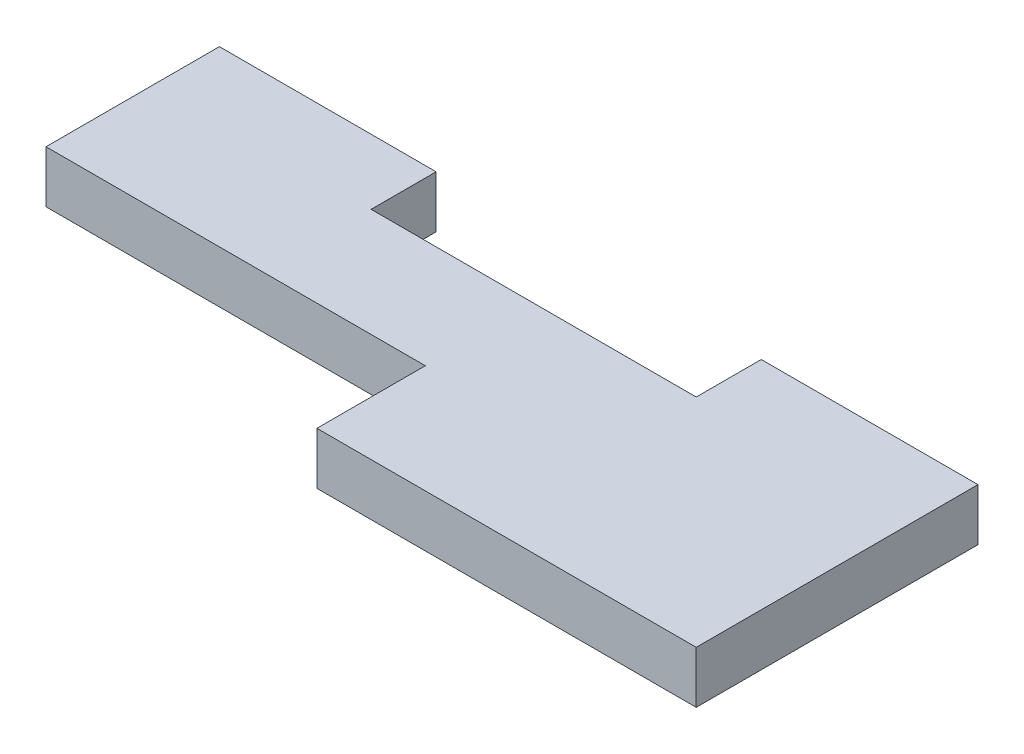
from build123d import *

# Parameters (mm, degrees)
BOSS_EXTRUDE1_DEPTH = 0.24


with BuildPart() as part:
    # Sketch1 → Boss-Extrude1 (new body)
    with BuildSketch(Plane(origin=(0, 0, 0), x_dir=(1, 0, 0), z_dir=(0, 1, 0))):
        Polygon((0, 1.3), (1, 1.3), (1, 1), (2.5, 1), (2.5, 1.3), (3.5, 1.3), (3.5, 0), (1.75, 0), (1.75, 0.5), (0, 0.5), align=None)
    extrude(amount=BOSS_EXTRUDE1_DEPTH)


solid = part.part
